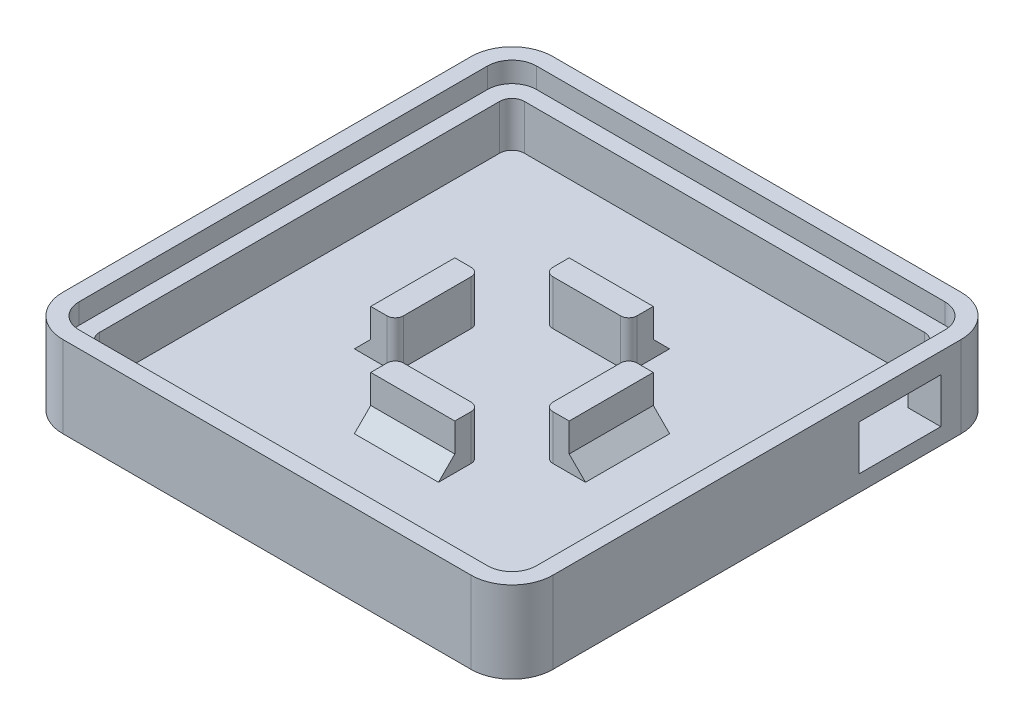
from build123d import *

# Parameters (mm, degrees)
ESBO_O1_W                = 60
ESBO_O1_H                = 60
BASE_DEPTH               = 2
ESBO_O3_W                = 24.3
ESBO_O3_H                = 24.3
ESBO_O3_W_2              = 18.3
ESBO_O3_H_2              = 18.3
ENCAIXES_DA_ARVORE_DEPTH = 5.5
ESBO_O4_W                = 60
ESBO_O4_H                = 60
ESBO_O4_W_2              = 52
ESBO_O4_H_2              = 52
PAREDES_DEPTH            = 8
ESBO_O5_W                = 7
ESBO_O5_H                = 7
CORTE_DOS_ENCAIXE_DEPTH  = 5.5
ESBO_O6_W                = 56
ESBO_O6_H                = 56
ESBO_O6_W_2              = 52
ESBO_O6_H_2              = 52
CORTE_EXTRUS_O2_DEPTH    = 2.5
FILETE5_R                = 1.5
FILETE6_R                = 3
ESBO_O7_W                = 10
ESBO_O7_H                = 5.5
CORTE_EXTRUS_O3_DEPTH    = 65.311740763
CHANFRO2_SIZE            = 2
FILETE19_R               = 1
FILETE20_R               = 5


with BuildPart() as part:
    # Esboço1 → Base (new body)
    with BuildSketch(Plane(origin=(0, 0, 0), x_dir=(1, 0, 0), z_dir=(0, 1, 0))):
        Rectangle(ESBO_O1_W, ESBO_O1_H)
    extrude(amount=BASE_DEPTH)

    # Esboço3 → Encaixes da Arvore (add)
    with BuildSketch(Plane(origin=(0, 2, 0), x_dir=(1, 0, 0), z_dir=(0, 1, 0))):
        Rectangle(ESBO_O3_W, ESBO_O3_H)
        Rectangle(ESBO_O3_W_2, ESBO_O3_H_2, mode=Mode.SUBTRACT)
    extrude(amount=ENCAIXES_DA_ARVORE_DEPTH)

    # Esboço4 → Paredes (add)
    with BuildSketch(Plane(origin=(0, 2, 0), x_dir=(1, 0, 0), z_dir=(0, 1, 0))):
        Rectangle(ESBO_O4_W, ESBO_O4_H)
        Rectangle(ESBO_O4_W_2, ESBO_O4_H_2, mode=Mode.SUBTRACT)
    extrude(amount=PAREDES_DEPTH)

    # Esboço5 → Corte dos Encaixe (cut)
    with BuildSketch(Plane(origin=(0, 7.5, 0), x_dir=(1, 0, 0), z_dir=(0, 1, 0))):
        with Locations((8.65, 8.65)):
            Rectangle(ESBO_O5_W, ESBO_O5_H)
        with Locations((-8.65, 8.65)):
            Rectangle(ESBO_O5_W, ESBO_O5_H)
        with Locations((8.65, -8.65)):
            Rectangle(ESBO_O5_W, ESBO_O5_H)
        with Locations((-8.65, -8.65)):
            Rectangle(ESBO_O5_W, ESBO_O5_H)
    extrude(amount=-CORTE_DOS_ENCAIXE_DEPTH, mode=Mode.SUBTRACT)

    # Esboço6 → Corte-extrusão2 (cut)
    with BuildSketch(Plane(origin=(0, 10, 0), x_dir=(1, 0, 0), z_dir=(0, 1, 0))):
        Rectangle(ESBO_O6_W, ESBO_O6_H)
        Rectangle(ESBO_O6_W_2, ESBO_O6_H_2, mode=Mode.SUBTRACT)
    extrude(amount=-CORTE_EXTRUS_O2_DEPTH, mode=Mode.SUBTRACT)

    # Filete5
    filete5_edges = [part.edges().sort_by_distance(p)[0] for p in [
        (26, 4.75, 26),
        (26, 4.75, -26),
        (-26, 4.75, 26),
        (-26, 4.75, -26),
    ]]
    fillet(filete5_edges, radius=FILETE5_R)

    # Filete6
    filete6_edges = [part.edges().sort_by_distance(p)[0] for p in [
        (-28, 8.75, 28),
        (-28, 8.75, -28),
        (28, 8.75, -28),
        (28, 8.75, 28),
    ]]
    fillet(filete6_edges, radius=FILETE6_R)

    # Esboço7 → Corte-extrusão3 (cut, through all)
    with BuildSketch(Plane.ZY.offset(-26)):
        with Locations((-17.5, 4.75)):
            Rectangle(ESBO_O7_W, ESBO_O7_H)
    extrude(amount=-CORTE_EXTRUS_O3_DEPTH, mode=Mode.SUBTRACT)

    # Chanfro2
    chanfro2_edges = [part.edges().sort_by_distance(p)[0] for p in [
        (-12.15, 2, 0),
        (0, 2, -12.15),
        (12.15, 2, 0),
        (0, 2, 12.15),
    ]]
    chamfer(chanfro2_edges, length=CHANFRO2_SIZE)

    # Filete19
    filete19_edges = [part.edges().sort_by_distance(p)[0] for p in [
        (9.15, 4.75, -5.15),
        (5.15, 4.75, -9.15),
        (5.15, 4.75, 9.15),
        (9.15, 4.75, 5.15),
        (-9.15, 4.75, 5.15),
        (-5.15, 4.75, 9.15),
        (-5.15, 4.75, -9.15),
        (-9.15, 4.75, -5.15),
    ]]
    fillet(filete19_edges, radius=FILETE19_R)

    # Filete20
    filete20_edges = [part.edges().sort_by_distance(p)[0] for p in [
        (30, 5, 30),
        (-30, 5, 30),
        (-30, 5, -30),
        (30, 5, -30),
    ]]
    fillet(filete20_edges, radius=FILETE20_R)


solid = part.part
